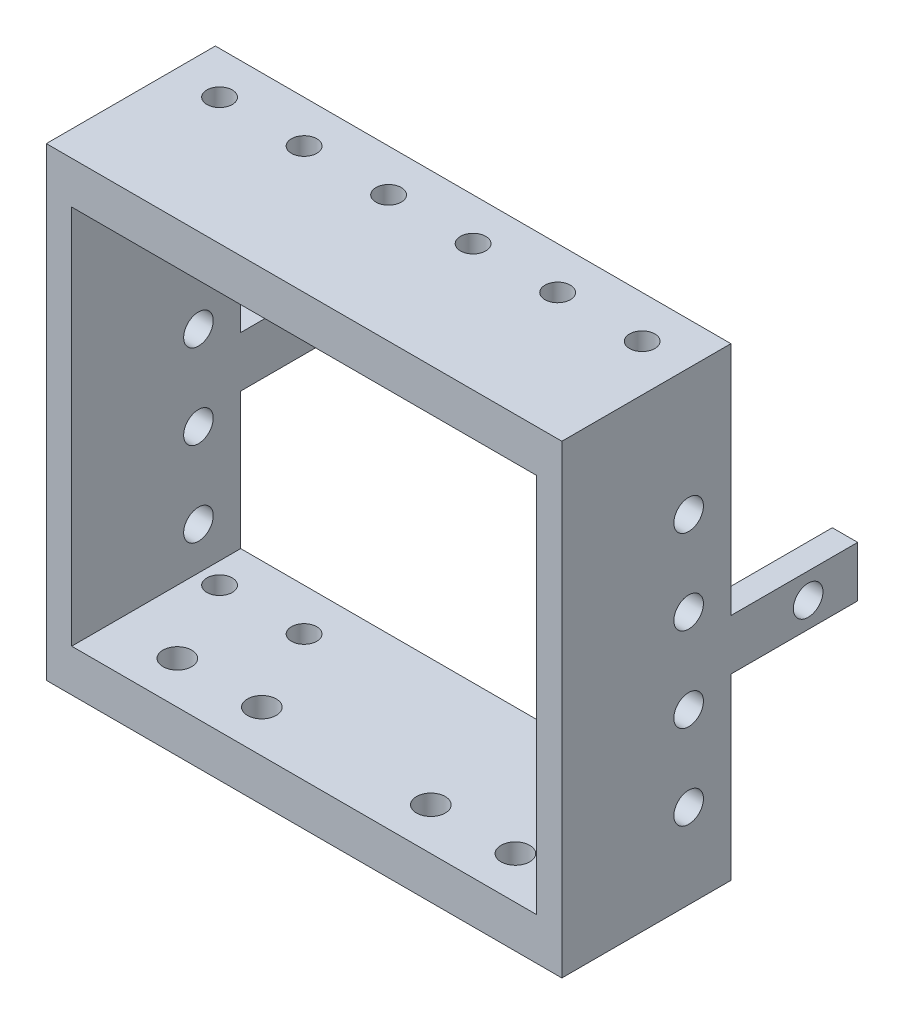
from build123d import *

# Parameters (mm, degrees)
SKETCH1_W           = 61
SKETCH1_H           = 10
SKETCH1_R           = 1.5
BOSS_EXTRUDE1_DEPTH = 5
SKETCH2_W           = 3
SKETCH2_H           = 10
BOSS_EXTRUDE2_DEPTH = 45
SKETCH3_R           = 1.75
CUT_EXTRUDE1_DEPTH  = 80.072172407
SKETCH4_W           = 15
SKETCH4_H           = 6
BOSS_EXTRUDE3_DEPTH = 3
SKETCH5_R           = 1.75
CUT_EXTRUDE2_DEPTH  = 82.52017035
SKETCH6_W           = 61
SKETCH6_H           = 10
SKETCH6_R           = 1.5
BOSS_EXTRUDE4_DEPTH = 5
SKETCH7_R           = 1.75
CUT_EXTRUDE3_DEPTH  = 85.679030308
SKETCH8_W           = 61
SKETCH8_H           = 55
SKETCH8_W_2         = 55
SKETCH8_H_2         = 45
BOSS_EXTRUDE5_DEPTH = 10
SKETCH13_R          = 1.7
CUT_EXTRUDE5_DEPTH  = 18


with BuildPart() as part:
    # Sketch1 → Boss-Extrude1 (new body)
    with BuildSketch(Plane(origin=(0, 0, 0), x_dir=(1, 0, 0), z_dir=(0, 1, 0))):
        with Locations((7.144615438, 0.604324155)):
            Rectangle(SKETCH1_W, SKETCH1_H)
        with Locations(Location((-17.855384562, 0.604324155, 0), (0, 0, 270))):
            Circle(SKETCH1_R, mode=Mode.SUBTRACT)
        with Locations(Location((-7.855384562, 0.604324155, 0), (0, 0, 270))):
            Circle(SKETCH1_R, mode=Mode.SUBTRACT)
        with Locations(Location((22.144615438, 0.604324155, 0), (0, 0, 270))):
            Circle(SKETCH1_R, mode=Mode.SUBTRACT)
        with Locations(Location((32.144615438, 0.604324155, 0), (0, 0, 270))):
            Circle(SKETCH1_R, mode=Mode.SUBTRACT)
    extrude(amount=BOSS_EXTRUDE1_DEPTH)

    # Sketch2 → Boss-Extrude2 (add)
    with BuildSketch(Plane(origin=(0, 5, 0), x_dir=(1, 0, 0), z_dir=(0, 1, 0))):
        with Locations((36.144615438, 0.604324155)):
            Rectangle(SKETCH2_W, SKETCH2_H)
        with Locations((-21.855384562, 0.604324155)):
            Rectangle(SKETCH2_W, SKETCH2_H)
    extrude(amount=BOSS_EXTRUDE2_DEPTH)

    # Sketch3 → Cut-Extrude1 (cut, through all)
    with BuildSketch(Plane.ZY.offset(23.355384562)):
        with Locations((-0.604324155, 10)):
            Circle(SKETCH3_R)
    extrude(amount=-CUT_EXTRUDE1_DEPTH, mode=Mode.SUBTRACT)

    # Sketch4 → Boss-Extrude3 (add)
    with BuildSketch(Plane.ZY.offset(23.355384562)):
        with Locations((-13.104324155, 24.14)):
            Rectangle(SKETCH4_W, SKETCH4_H)
    boss_extrude3 = extrude(amount=-BOSS_EXTRUDE3_DEPTH)

    # Mirror1: Boss-Extrude3 across plane
    add(boss_extrude3.mirror(Plane.ZY.offset(-7.144615438)))

    # Sketch5 → Cut-Extrude2 (cut, through all)
    with BuildSketch(Plane.ZY.offset(23.355384562)):
        with Locations((-14.744324155, 24.14)):
            Circle(SKETCH5_R)
    extrude(amount=-CUT_EXTRUDE2_DEPTH, mode=Mode.SUBTRACT)

    # Sketch6 → Boss-Extrude4 (add)
    with BuildSketch(Plane(origin=(0, 50, 0), x_dir=(1, 0, 0), z_dir=(0, 1, 0))):
        with Locations((7.144615438, 0.604324155)):
            Rectangle(SKETCH6_W, SKETCH6_H)
        with Locations(Location((2.144615438, 0.604324155, 0), (0, 0, 270))):
            Circle(SKETCH6_R, mode=Mode.SUBTRACT)
        with Locations(Location((12.144615438, 0.604324155, 0), (0, 0, 270))):
            Circle(SKETCH6_R, mode=Mode.SUBTRACT)
        with Locations(Location((-7.855384562, 0.604324155, 0), (0, 0, 270))):
            Circle(SKETCH6_R, mode=Mode.SUBTRACT)
        with Locations(Location((-17.855384562, 0.604324155, 0), (0, 0, 270))):
            Circle(SKETCH6_R, mode=Mode.SUBTRACT)
        with Locations(Location((22.144615438, 0.604324155, 0), (0, 0, 270))):
            Circle(SKETCH6_R, mode=Mode.SUBTRACT)
        with Locations(Location((32.144615438, 0.604324155, 0), (0, 0, 270))):
            Circle(SKETCH6_R, mode=Mode.SUBTRACT)
    extrude(amount=BOSS_EXTRUDE4_DEPTH)

    # Sketch7 → Cut-Extrude3 (cut, through all)
    with BuildSketch(Plane.ZY.offset(23.355384562)):
        with Locations((-0.604324155, 10)):
            Circle(SKETCH7_R)
        with Locations((-0.604324155, 20)):
            Circle(SKETCH7_R)
        with Locations((-0.604324155, 30)):
            Circle(SKETCH7_R)
        with Locations((-0.604324155, 40)):
            Circle(SKETCH7_R)
    extrude(amount=-CUT_EXTRUDE3_DEPTH, mode=Mode.SUBTRACT)

    # Sketch8 → Boss-Extrude5 (add)
    with BuildSketch(Plane.XY.offset(4.395675845)):
        with Locations((7.144615438, 27.5)):
            Rectangle(SKETCH8_W, SKETCH8_H)
        with Locations((7.144615438, 27.5)):
            Rectangle(SKETCH8_W_2, SKETCH8_H_2, mode=Mode.SUBTRACT)
    extrude(amount=BOSS_EXTRUDE5_DEPTH)

    # Sketch13 → Cut-Extrude5 (cut)
    with BuildSketch(Plane.XZ):
        with Locations(Location((-2.855384562, 9.395675845, 0), (0, 0, 270))):
            Circle(SKETCH13_R)
        with Locations(Location((-12.855384562, 9.395675845, 0), (0, 0, 270))):
            Circle(SKETCH13_R)
        with Locations(Location((17.144615438, 9.395675845, 0), (0, 0, 270))):
            Circle(SKETCH13_R)
        with Locations(Location((27.144615438, 9.395675845, 0), (0, 0, 270))):
            Circle(SKETCH13_R)
    extrude(amount=-CUT_EXTRUDE5_DEPTH, mode=Mode.SUBTRACT)


solid = part.part
